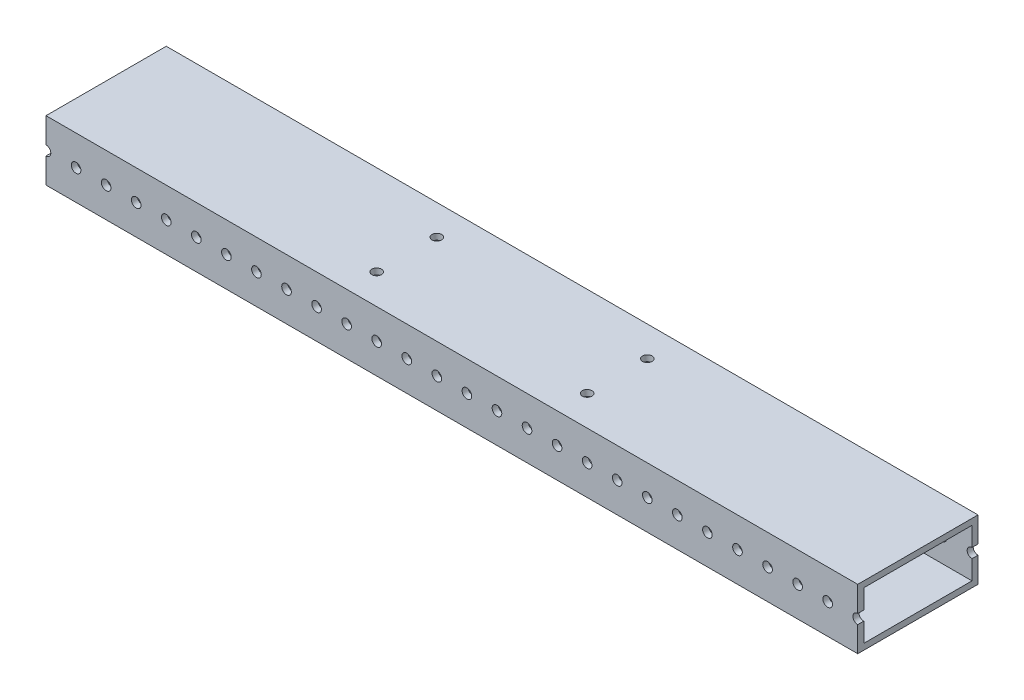
from build123d import *

# Parameters (mm, degrees)
SKETCH1_W           = 50.8
SKETCH1_H           = 25.4
SKETCH1_W_2         = 45.72
SKETCH1_H_2         = 20.32
BOSS_EXTRUDE1_DEPTH = 171.45
SKETCH2_R           = 2.032
CUT_EXTRUDE1_DEPTH  = 180.268046511
SKETCH3_R           = 2.032
CUT_EXTRUDE2_DEPTH  = 176.172550646


with BuildPart() as part:
    # Sketch1 → Boss-Extrude1 (new, symmetric)
    with BuildSketch(Plane(origin=(0, 0, 0), x_dir=(0, 0, -1), z_dir=(1, 0, 0))):
        Rectangle(SKETCH1_W, SKETCH1_H)
        Rectangle(SKETCH1_W_2, SKETCH1_H_2, mode=Mode.SUBTRACT)
    extrude(amount=BOSS_EXTRUDE1_DEPTH, both=True)

    # Sketch2 → Cut-Extrude1 (cut, through all)
    with BuildSketch(Plane.XY.offset(25.4)):
        with Locations((-171.45, 0)):
            Circle(SKETCH2_R)
        with Locations((-158.75, 0)):
            Circle(SKETCH2_R)
        with Locations((-146.05, 0)):
            Circle(SKETCH2_R)
        with Locations((-133.35, 0)):
            Circle(SKETCH2_R)
        with Locations((-120.65, 0)):
            Circle(SKETCH2_R)
        with Locations((-107.95, 0)):
            Circle(SKETCH2_R)
        with Locations((-95.25, 0)):
            Circle(SKETCH2_R)
        with Locations((-82.55, 0)):
            Circle(SKETCH2_R)
        with Locations((-69.85, 0)):
            Circle(SKETCH2_R)
        with Locations((-57.15, 0)):
            Circle(SKETCH2_R)
        with Locations((-44.45, 0)):
            Circle(SKETCH2_R)
        with Locations((-31.75, 0)):
            Circle(SKETCH2_R)
        with Locations((-19.05, 0)):
            Circle(SKETCH2_R)
        with Locations((-6.35, 0)):
            Circle(SKETCH2_R)
        with Locations((6.35, 0)):
            Circle(SKETCH2_R)
        with Locations((19.05, 0)):
            Circle(SKETCH2_R)
        with Locations((31.75, 0)):
            Circle(SKETCH2_R)
        with Locations((44.45, 0)):
            Circle(SKETCH2_R)
        with Locations((57.15, 0)):
            Circle(SKETCH2_R)
        with Locations((69.85, 0)):
            Circle(SKETCH2_R)
        with Locations((82.55, 0)):
            Circle(SKETCH2_R)
        with Locations((95.25, 0)):
            Circle(SKETCH2_R)
        with Locations((107.95, 0)):
            Circle(SKETCH2_R)
        with Locations((120.65, 0)):
            Circle(SKETCH2_R)
        with Locations((133.35, 0)):
            Circle(SKETCH2_R)
        with Locations((146.05, 0)):
            Circle(SKETCH2_R)
        with Locations((158.75, 0)):
            Circle(SKETCH2_R)
        with Locations((171.45, 0)):
            Circle(SKETCH2_R)
        with Locations((184.15, 0)):
            Circle(SKETCH2_R)
        with Locations((196.85, 0)):
            Circle(SKETCH2_R)
        with Locations((209.55, 0)):
            Circle(SKETCH2_R)
        with Locations((222.25, 0)):
            Circle(SKETCH2_R)
        with Locations((234.95, 0)):
            Circle(SKETCH2_R)
        with Locations((247.65, 0)):
            Circle(SKETCH2_R)
        with Locations((260.35, 0)):
            Circle(SKETCH2_R)
        with Locations((273.05, 0)):
            Circle(SKETCH2_R)
        with Locations((285.75, 0)):
            Circle(SKETCH2_R)
        with Locations((298.45, 0)):
            Circle(SKETCH2_R)
        with Locations((311.15, 0)):
            Circle(SKETCH2_R)
        with Locations((323.85, 0)):
            Circle(SKETCH2_R)
    extrude(amount=-CUT_EXTRUDE1_DEPTH, mode=Mode.SUBTRACT)

    # Sketch3 → Cut-Extrude2 (cut, through all)
    with BuildSketch(Plane.XZ.offset(12.7)):
        with Locations(Location((44.45, 12.7, 0), (0, 0, 270))):
            Circle(SKETCH3_R)
        with Locations(Location((44.45, -12.7, 0), (0, 0, 270))):
            Circle(SKETCH3_R)
        with Locations(Location((-44.45, -12.7, 0), (0, 0, 270))):
            Circle(SKETCH3_R)
        with Locations(Location((-44.45, 12.7, 0), (0, 0, 270))):
            Circle(SKETCH3_R)
    extrude(amount=-CUT_EXTRUDE2_DEPTH, mode=Mode.SUBTRACT)


solid = part.part
